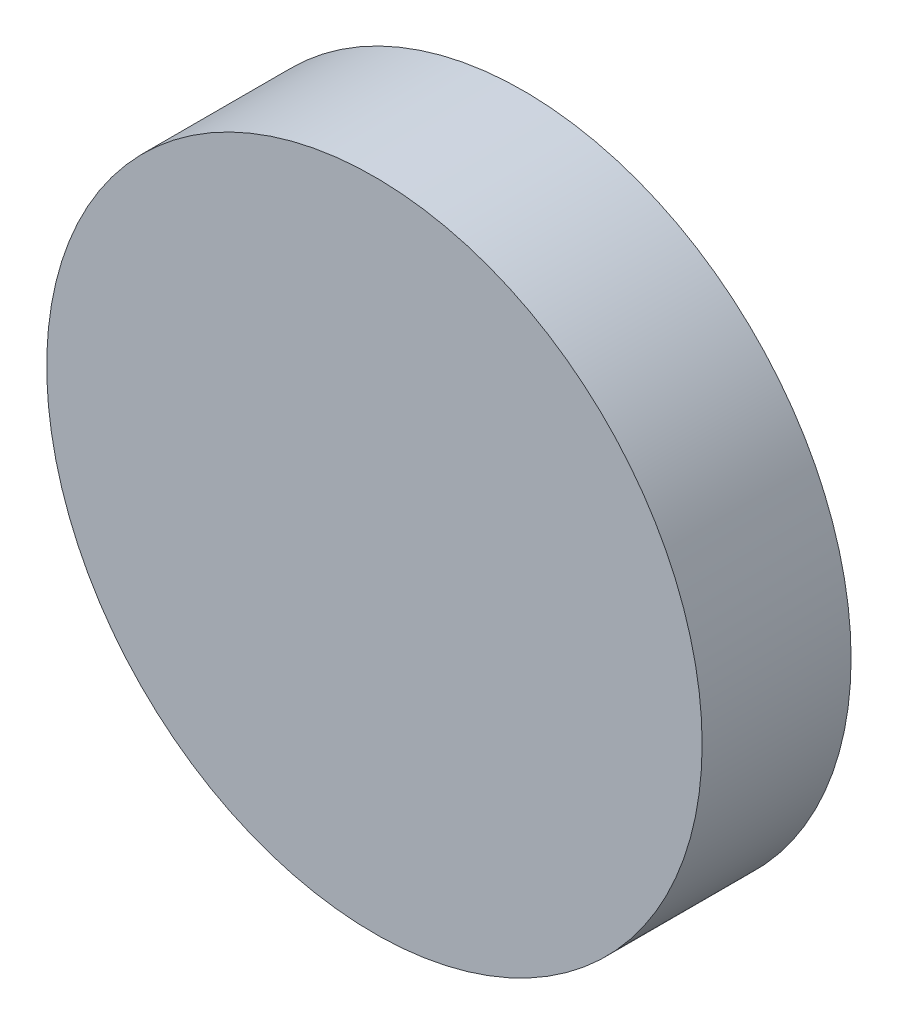
from build123d import *

# Parameters (mm, degrees)
SKETCH_1_R      = 55
EXTRUDE_1_DEPTH = 25


with BuildPart() as part:
    # 草图1 → 凸台-拉伸1 (new body)
    with BuildSketch(Plane.XY):
        Circle(SKETCH_1_R)
    extrude(amount=-EXTRUDE_1_DEPTH)


solid = part.part
